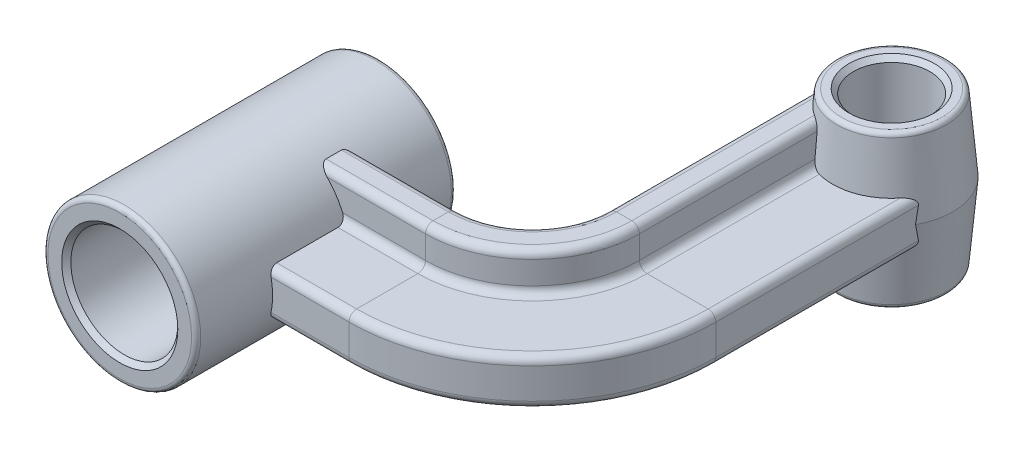
from build123d import *

# Parameters (mm, degrees)
BOSS_EXTRUDE1_DEPTH           = 120
BOSS_EXTRUDE1_DEPTH_BACK      = 50
SKETCH1_R                     = 50
SKETCH4_R                     = 40
BOSS_EXTRUDE4_DEPTH           = 50
BOSS_EXTRUDE4_TAPER           = 5
BOSS_EXTRUDE4_OTHER_WAY_DEPTH = 50
BOSS_EXTRUDE4_OTHER_WAY_TAPER = 5
SKETCH5_R                     = 25
CUT_EXTRUDE1_DEPTH            = 344.838625103
SKETCH6_R                     = 35
CUT_EXTRUDE2_DEPTH            = 428.463448878
FILLET1_R                     = 3
CHAMFER1_SIZE                 = 3


with BuildPart() as part:
    # Sketch1 → Boss-Extrude1 (new, two sides: drawn at the far end of the back side and taken through both)
    with BuildSketch(Plane.XY.offset(-BOSS_EXTRUDE1_DEPTH_BACK)):
        Circle(SKETCH1_R)
    extrude(amount=BOSS_EXTRUDE1_DEPTH + BOSS_EXTRUDE1_DEPTH_BACK)

    # Sweep1: sweep along a path in Sketch3
    with BuildLine(Plane(origin=(0, 0, 0), x_dir=(1, 0, 0), z_dir=(0, 1, 0))) as sweep1_path:
        Line((0, 0), (100, 0))
        ThreePointArc((100, 0), (135.355339059, 14.644660941), (150, 50))
        Line((150, 50), (150, 200))
    # Sketch2 → Sweep1 (sweep)
    with BuildSketch(Plane(origin=(0, 0, 0), x_dir=(0, 0, -1), z_dir=(1, 0, 0))):
        with BuildLine():
            Line((0, -35), (0, 35))
            ThreePointArc((0, 35), (-1.464466094, 38.535533906), (-5, 40))
            Line((-5, 40), (-15, 40))
            ThreePointArc((-15, 40), (-18.535533906, 38.535533906), (-20, 35))
            Line((-20, 35), (-20, 20))
            ThreePointArc((-20, 20), (-21.464466094, 16.464466094), (-25, 15))
            Line((-25, 15), (-65, 15))
            ThreePointArc((-65, 15), (-68.535533906, 13.535533906), (-70, 10))
            Line((-70, 10), (-70, -10))
            ThreePointArc((-70, -10), (-68.535533906, -13.535533906), (-65, -15))
            Line((-65, -15), (-25, -15))
            ThreePointArc((-25, -15), (-21.464466094, -16.464466094), (-20, -20))
            Line((-20, -20), (-20, -35))
            ThreePointArc((-20, -35), (-18.535533906, -38.535533906), (-15, -40))
            Line((-15, -40), (-5, -40))
            ThreePointArc((-5, -40), (-1.464466094, -38.535533906), (0, -35))
        make_face()
    sweep(path=sweep1_path.line)

    # Sketch4 → Boss-Extrude4 (add)
    with BuildSketch(Plane(origin=(0, 0, 0), x_dir=(1, 0, 0), z_dir=(0, 1, 0))):
        with Locations((185, 200)):
            Circle(SKETCH4_R)
    extrude(amount=BOSS_EXTRUDE4_DEPTH, taper=BOSS_EXTRUDE4_TAPER)

    # Sketch4 → Boss-Extrude4 other way (add)
    with BuildSketch(Plane(origin=(0, 0, 0), x_dir=(1, 0, 0), z_dir=(0, 1, 0))):
        with Locations((185, 200)):
            Circle(SKETCH4_R)
    extrude(amount=-BOSS_EXTRUDE4_OTHER_WAY_DEPTH, taper=BOSS_EXTRUDE4_OTHER_WAY_TAPER)

    # Sketch5 → Cut-Extrude1 (cut, through all)
    with BuildSketch(Plane(origin=(0, 50, 0), x_dir=(1, 0, 0), z_dir=(0, 1, 0))):
        with Locations(Location((185, 200, 0), (0, 0, 270))):
            Circle(SKETCH5_R)
    extrude(amount=-CUT_EXTRUDE1_DEPTH, mode=Mode.SUBTRACT)

    # Sketch6 → Cut-Extrude2 (cut, through all)
    with BuildSketch(Plane.XY.offset(120)):
        Circle(SKETCH6_R)
    extrude(amount=-CUT_EXTRUDE2_DEPTH, mode=Mode.SUBTRACT)

    # Fillet1
    fillet1_edges = [part.edges().sort_by_distance(p)[0] for p in [
        (149.374433176, -50, -200),
        (149.374433176, 50, -200),
        (-50, 0, -50),
        (-50, 0, 120),
    ]]
    fillet(fillet1_edges, radius=FILLET1_R)

    # Chamfer1
    chamfer1_edges = [part.edges().sort_by_distance(p)[0] for p in [
        (185, -50, -225),
        (185, 50, -225),
        (-35, 0, -50),
        (-35, 0, 120),
    ]]
    chamfer(chamfer1_edges, length=CHAMFER1_SIZE)


solid = part.part
